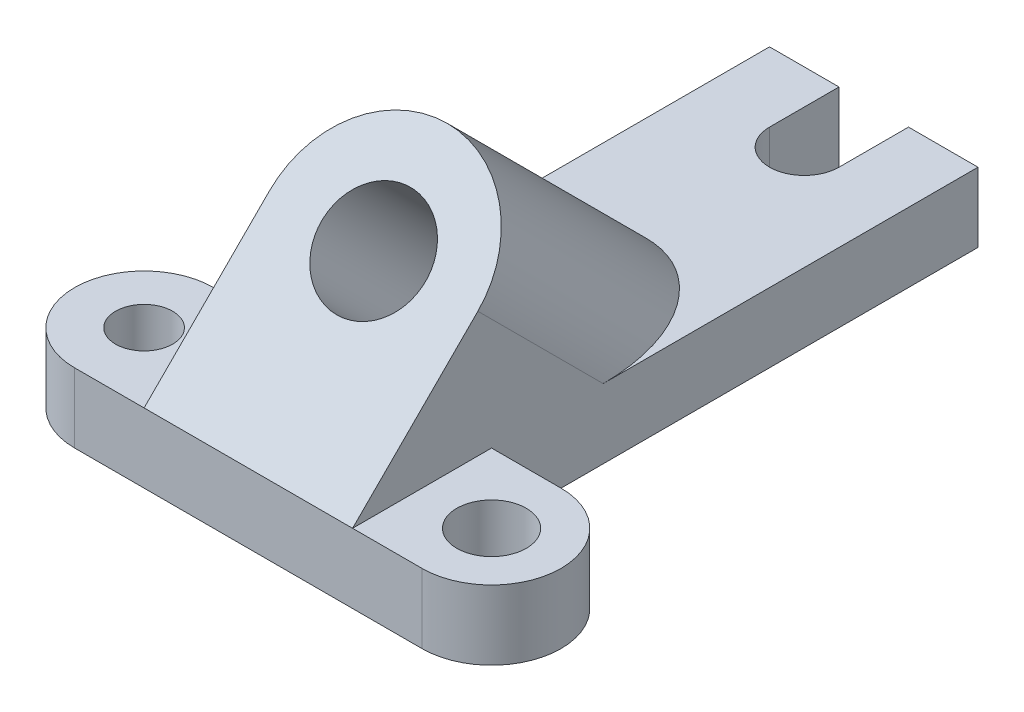
from build123d import *

# Parameters (mm, degrees)
SKETCH1_R           = 20
SKETCH1_R_2         = 8.217303111
SKETCH1_R_3         = 10
BOSS_EXTRUDE1_DEPTH = 20
CUT_EXTRUDE1_DEPTH  = 20
BOSS_EXTRUDE2_REACH = 168.813


with BuildPart() as part:
    # Sketch1 → Boss-Extrude1 (new body)
    # profile 1 of 3: a face of its own
    with BuildSketch(Plane(origin=(0, 0, 0), x_dir=(1, 0, 0), z_dir=(0, 1, 0))):
        with Locations((-50, -63.493082487)):
            Circle(SKETCH1_R)
        with Locations(Location((-50, -63.493082487, 0), (0, 0, 270))):
            Circle(SKETCH1_R_2, mode=Mode.SUBTRACT)
    # profile 2 of 3: a face of its own
    with BuildSketch(Plane(origin=(0, 0, 0), x_dir=(1, 0, 0), z_dir=(0, 1, 0))):
        with Locations((50, -63.493082487)):
            Circle(SKETCH1_R)
        with Locations(Location((50, -63.493082487, 0), (0, 0, 270))):
            Circle(SKETCH1_R_3, mode=Mode.SUBTRACT)
    # profile 3 of 3: a face of its own
    with BuildSketch(Plane(origin=(0, 0, 0), x_dir=(1, 0, 0), z_dir=(0, 1, 0))):
        with BuildLine():
            Line((50, -43.493082487), (30, -43.493082487))
            Line((30, -43.493082487), (30, 96.506917513))
            Line((30, 96.506917513), (-30, 96.506917513))
            Line((-30, 96.506917513), (-30, -43.493082487))
            Line((-30, -43.493082487), (-50, -43.493082487))
            ThreePointArc((-50, -43.493082487), (-35.857864376, -49.350946863), (-30, -63.493082487))
            ThreePointArc((-30, -63.493082487), (-35.857864376, -77.635218111), (-50, -83.493082487))
            Line((-50, -83.493082487), (50, -83.493082487))
            ThreePointArc((50, -83.493082487), (30, -63.493082487), (50, -43.493082487))
        make_face()
    extrude(amount=-BOSS_EXTRUDE1_DEPTH)

    # Sketch2 → Cut-Extrude1 (cut)
    with BuildSketch(Plane(origin=(0, 0, 0), x_dir=(1, 0, 0), z_dir=(0, 1, 0))):
        with BuildLine():
            Line((-10, 96.506917513), (10, 96.506917513))
            Line((10, 96.506917513), (10, 76.506917513))
            ThreePointArc((10, 76.506917513), (0, 66.506917513), (-10, 76.506917513))
            Line((-10, 76.506917513), (-10, 96.506917513))
        make_face()
    extrude(amount=-CUT_EXTRUDE1_DEPTH, mode=Mode.SUBTRACT)

    # Sketch5 → Boss-Extrude2 (add, up to next)
    with BuildSketch(Plane(origin=(0, 41.746541244, 41.746541244), x_dir=(1, 0, 0), z_dir=(0, 0.7071067811865511, 0.707106781186544)), mode=Mode.PRIVATE) as boss_extrude2_sk1:
        with BuildLine():
            Line((-30, -8.038524809), (-30, -59.038524809))
            Line((-30, -59.038524809), (30, -59.038524809))
            Line((30, -59.038524809), (30, -8.038524809))
            ThreePointArc((30, -8.038524809), (0, -38.038524809), (-30, -8.038524809))
        make_face()
    boss_extrude2_tool1 = extrude(boss_extrude2_sk1.sketch, amount=-BOSS_EXTRUDE2_REACH, mode=Mode.PRIVATE) - part.part
    # Sketch5 → Boss-Extrude2 (add, up to next)
    with BuildSketch(Plane(origin=(0, 41.746541244, 41.746541244), x_dir=(1, 0, 0), z_dir=(0, 0.7071067811865511, 0.707106781186544)), mode=Mode.PRIVATE) as boss_extrude2_sk2:
        with BuildLine():
            ThreePointArc((30, -8.038524809), (0, 21.961475191), (-30, -8.038524809))
            Line((-30, -8.038524809), (-15, -8.038524809))
            ThreePointArc((-15, -8.038524809), (0, 6.961475191), (15, -8.038524809))
            Line((15, -8.038524809), (30, -8.038524809))
        make_face()
    boss_extrude2_tool2 = extrude(boss_extrude2_sk2.sketch, amount=-BOSS_EXTRUDE2_REACH, mode=Mode.PRIVATE) - part.part
    # Sketch5 → Boss-Extrude2 (add, up to next)
    with BuildSketch(Plane(origin=(0, 41.746541244, 41.746541244), x_dir=(1, 0, 0), z_dir=(0, 0.7071067811865511, 0.707106781186544)), mode=Mode.PRIVATE) as boss_extrude2_sk3:
        with BuildLine():
            Line((-15, -8.038524809), (-30, -8.038524809))
            ThreePointArc((-30, -8.038524809), (0, -38.038524809), (30, -8.038524809))
            Line((30, -8.038524809), (15, -8.038524809))
            ThreePointArc((15, -8.038524809), (0, -23.038524809), (-15, -8.038524809))
        make_face()
    boss_extrude2_tool3 = extrude(boss_extrude2_sk3.sketch, amount=-BOSS_EXTRUDE2_REACH, mode=Mode.PRIVATE) - part.part
    # Sketch5 → Boss-Extrude2 (add, up to next)
    with BuildSketch(Plane(origin=(0, 41.746541244, 41.746541244), x_dir=(1, 0, 0), z_dir=(0, 0.7071067811865511, 0.707106781186544)), mode=Mode.PRIVATE) as boss_extrude2_sk4:
        with BuildLine():
            ThreePointArc((30, -8.038524809), (0, 21.961475191), (-30, -8.038524809))
            Line((-30, -8.038524809), (-15, -8.038524809))
            ThreePointArc((-15, -8.038524809), (0, 6.961475191), (15, -8.038524809))
            Line((15, -8.038524809), (30, -8.038524809))
        make_face()
    boss_extrude2_tool4 = extrude(boss_extrude2_sk4.sketch, amount=-BOSS_EXTRUDE2_REACH, mode=Mode.PRIVATE) - part.part
    # Sketch5 → Boss-Extrude2 (add, up to next)
    with BuildSketch(Plane(origin=(0, 41.746541244, 41.746541244), x_dir=(1, 0, 0), z_dir=(0, 0.7071067811865511, 0.707106781186544)), mode=Mode.PRIVATE) as boss_extrude2_sk5:
        with BuildLine():
            Line((-15, -8.038524809), (-30, -8.038524809))
            ThreePointArc((-30, -8.038524809), (0, -38.038524809), (30, -8.038524809))
            Line((30, -8.038524809), (15, -8.038524809))
            ThreePointArc((15, -8.038524809), (0, -23.038524809), (-15, -8.038524809))
        make_face()
    boss_extrude2_tool5 = extrude(boss_extrude2_sk5.sketch, amount=-BOSS_EXTRUDE2_REACH, mode=Mode.PRIVATE) - part.part
    add(boss_extrude2_tool1.solids().sort_by_distance((0, 10.278536, 73.214546))[0])
    add(boss_extrude2_tool2.solids().sort_by_distance((0, 47.143389, 36.349693))[0])
    add(boss_extrude2_tool3.solids().sort_by_distance((22.5, 35.588104, 47.904978))[0])
    add(boss_extrude2_tool4.solids().sort_by_distance((0, 47.143389, 36.349693))[0])
    add(boss_extrude2_tool5.solids().sort_by_distance((22.5, 35.588104, 47.904978))[0])


solid = part.part
